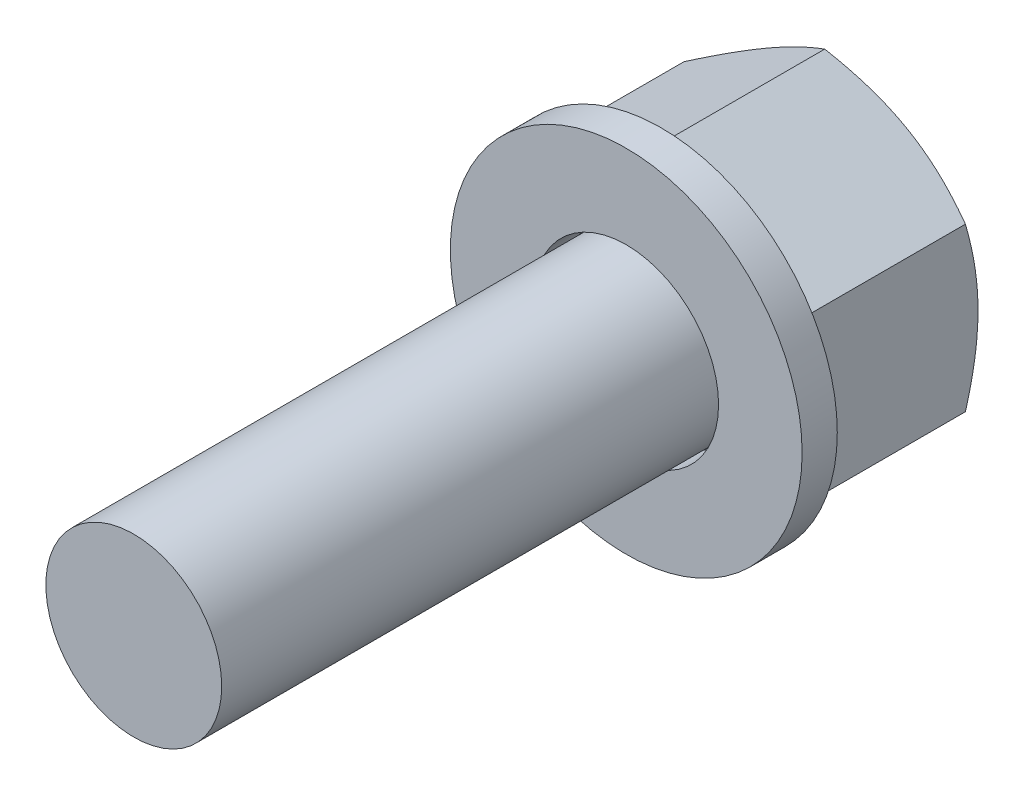
from build123d import *

# Parameters (mm, degrees)
SKETCH1_R           = 5
BOSS_EXTRUDE1_DEPTH = 10
BOSS_EXTRUDE2_START = 10
SKETCH1_3_R         = 5
BOSS_EXTRUDE2_DEPTH = 30
BOSS_EXTRUDE3_START = 10
SKETCH3_R           = 10
SKETCH3_R_2         = 5.25
BOSS_EXTRUDE3_DEPTH = 2


with BuildPart() as part:
    # Sketch1 → Boss-Extrude1 (new body)
    # profile 1 of 2: a face of its own
    with BuildSketch(Plane.XY):
        Polygon((-11.163210479, -1.701501358), (-3.163210479, 2.917300796), (-3.163210479, 12.154905103), (-11.163210479, 16.773707256), (-19.163210479, 12.154905103), (-19.163210479, 2.917300796), align=None)
        with Locations((-11.163210479, 7.536102949)):
            Circle(SKETCH1_R, mode=Mode.SUBTRACT)
    # profile 2 of 2: a face of its own
    with BuildSketch(Plane.XY):
        with Locations((-11.163210479, 7.536102949)):
            Circle(SKETCH1_R)
    extrude(amount=BOSS_EXTRUDE1_DEPTH)

    # Sketch1<3> → Boss-Extrude2 (add)
    with BuildSketch(Plane.XY.offset(BOSS_EXTRUDE2_START)):
        with Locations((-11.163210479, 7.536102949)):
            Circle(SKETCH1_3_R)
    extrude(amount=BOSS_EXTRUDE2_DEPTH)

    # Sketch6 → Cut-Revolve2 (revolve, cut)
    with BuildSketch(Plane(origin=(0, 7.536102949, 0), x_dir=(-1, 0, 0), z_dir=(0, -1, 0))):
        Polygon((16.038854826, 4.803847577), (16.038854826, 1.803847577), (28.163210479, -5.196152423), (30.038854826, -5.196152423), (30.038854826, 4.803847577), align=None)
    revolve(axis=Axis((-11.163210479, 7.536102949, 10.5), (0, 0, -1)), mode=Mode.SUBTRACT)


with BuildPart() as body_2:
    # Sketch3 → Boss-Extrude3 (new body)
    with BuildSketch(Plane.XY.offset(BOSS_EXTRUDE3_START)):
        with Locations((-11.163210479, 7.536102949)):
            Circle(SKETCH3_R)
        with Locations((-11.163210479, 7.536102949)):
            Circle(SKETCH3_R_2, mode=Mode.SUBTRACT)
    extrude(amount=BOSS_EXTRUDE3_DEPTH)


solid = Compound([part.part, body_2.part])
